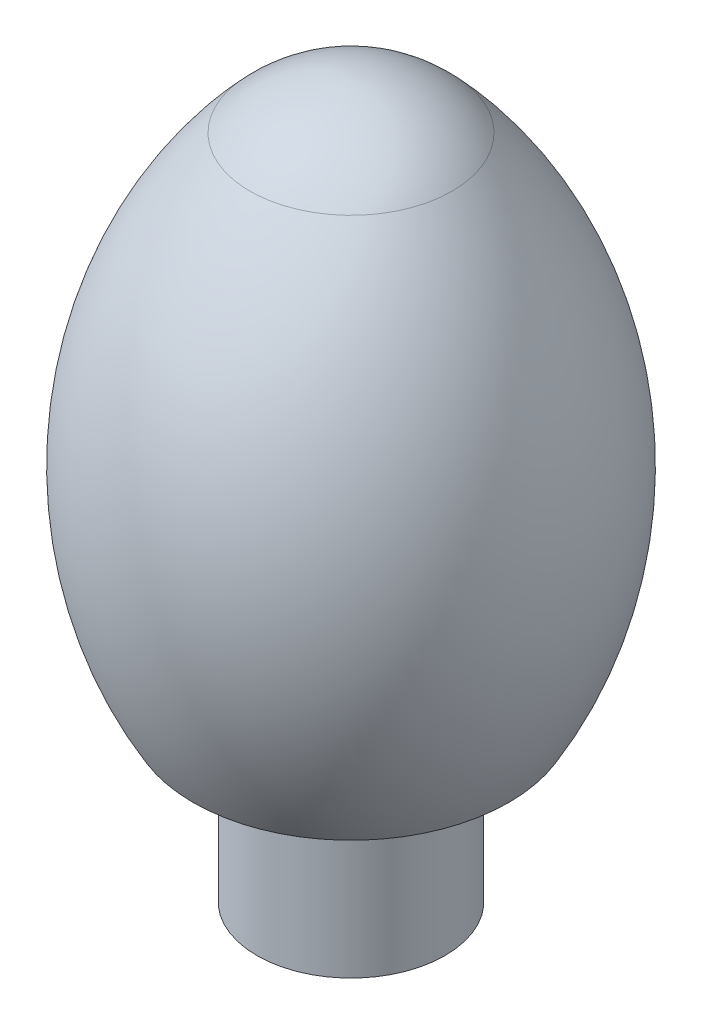
from build123d import *

# Parameters (mm, degrees)
SKETCH1_R           = 5.08
BOSS_EXTRUDE1_DEPTH = 10.16


with BuildPart() as part:
    # Sketch1 → Boss-Extrude1 (new body)
    with BuildSketch(Plane(origin=(0, 0, 0), x_dir=(1, 0, 0), z_dir=(0, 1, 0))):
        with Locations(Location((0, 0, 0), (0, 0, 270))):
            Circle(SKETCH1_R)
    extrude(amount=BOSS_EXTRUDE1_DEPTH)

    # Sketch2 → Revolve1 (revolve)
    with BuildSketch(Plane.XY):
        with BuildLine():
            Line((0, 38.445132368), (0, 8.89))
            Line((0, 8.89), (8.529888413, 8.89))
            ThreePointArc((8.529888413, 8.89), (11.485386278, 22.936370775), (5.465721259, 35.967070396))
            ThreePointArc((5.465721259, 35.967070396), (2.979067065, 37.749145004), (0, 38.445132368))
        make_face()
    revolve(axis=Axis((0, 8.89, 0), (0, 1, 0)))


solid = part.part
